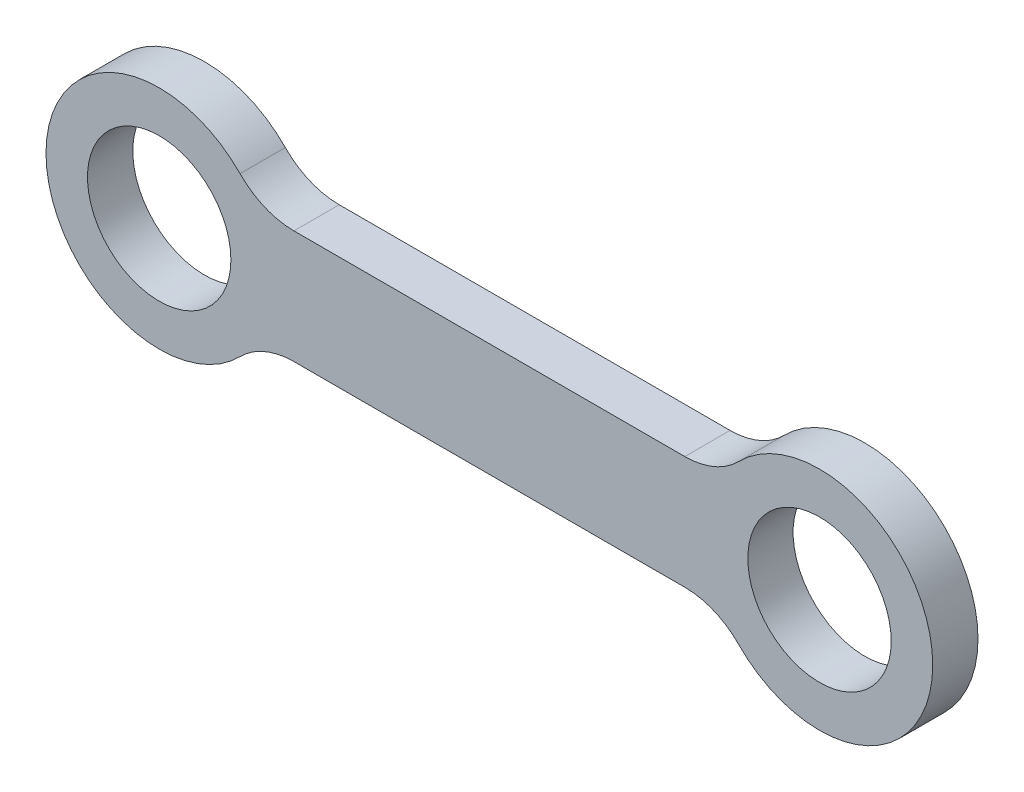
from build123d import *

# Parameters (mm, degrees)
SZKIC1_R                    = 9.5
DODANIE_WYCI_GNI_CIE1_DEPTH = 3
ZAOKR_GLENIE1_R             = 10


with BuildPart() as part:
    # Szkic1 → Dodanie-wyciągnięcie1 (new, symmetric)
    with BuildSketch(Plane.XY):
        with BuildLine():
            Line((-12.990381057, 7.5), (-74.509618943, 7.5))
            ThreePointArc((-74.509618943, 7.5), (-94.991658931, 12.995193206), (-100.5, -7.483314774))
            ThreePointArc((-100.5, -7.483314774), (-87.509629653, -14.999996909), (-74.509618943, -7.5))
            Line((-74.509618943, -7.5), (-12.990381057, -7.5))
            ThreePointArc((-12.990381057, -7.5), (0, -15), (12.990381057, -7.5))
            ThreePointArc((12.990381057, -7.5), (7.5, 12.990381057), (-12.990381057, 7.5))
        make_face()
        with Locations((-87.5, 0)):
            Circle(SZKIC1_R, mode=Mode.SUBTRACT)
        Circle(SZKIC1_R, mode=Mode.SUBTRACT)
    extrude(amount=DODANIE_WYCI_GNI_CIE1_DEPTH, both=True)

    # Zaokrąglenie1
    zaokr_glenie1_edges = [part.edges().sort_by_distance(p)[0] for p in [
        (-74.509618943, 7.5, -1.5),
        (-12.990381057, 7.5, -1.5),
        (-12.990381057, -7.5, -1.5),
        (-74.509618943, -7.5, -1.5),
    ]]
    fillet(zaokr_glenie1_edges, radius=ZAOKR_GLENIE1_R)


solid = part.part
